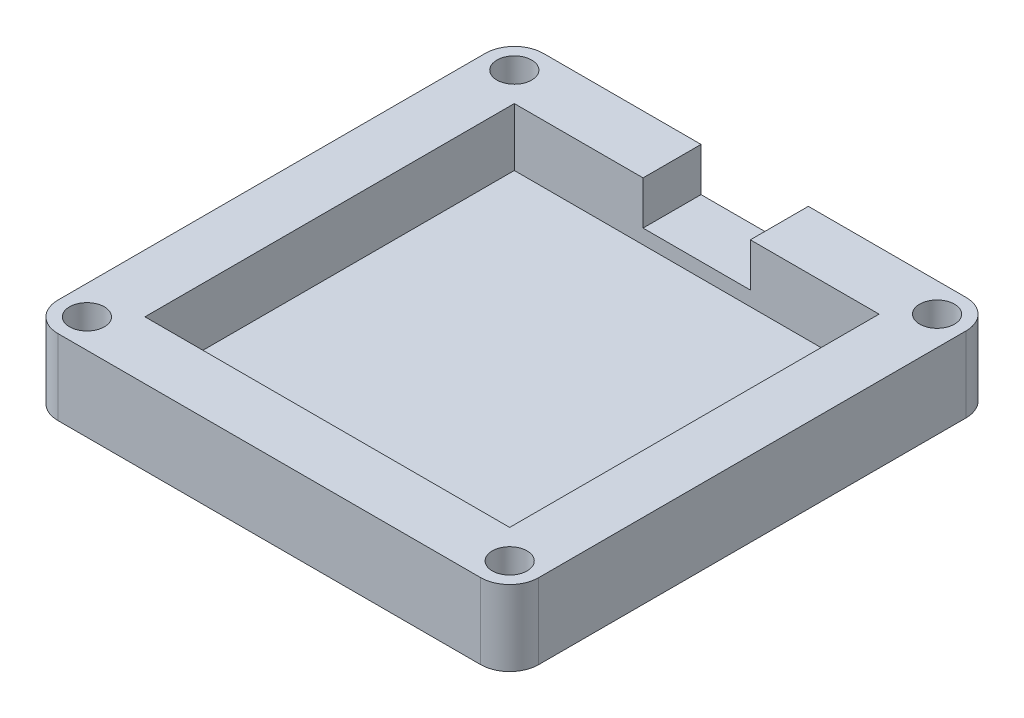
from build123d import *

# Parameters (mm, degrees)
SKETCH1_W           = 82.9
SKETCH1_H           = 83.7
SKETCH1_R           = 3
SKETCH1_W_2         = 62.9
SKETCH1_H_2         = 63.7
BOSS_EXTRUDE1_DEPTH = 13
SKETCH1_4_W         = 62.9
SKETCH1_4_H         = 63.7
BOSS_EXTRUDE2_DEPTH = 3
SKETCH2_W           = 18.5
SKETCH2_H           = 10
CUT_EXTRUDE1_DEPTH  = 7.5
FILLET1_R           = 5


with BuildPart() as part:
    # Sketch1 → Boss-Extrude1 (new body)
    with BuildSketch(Plane(origin=(0, 0, 0), x_dir=(1, 0, 0), z_dir=(0, 1, 0))):
        with Locations((-33.914696313, -1.170240017)):
            Rectangle(SKETCH1_W, SKETCH1_H)
        with Locations((-70.364696313, -38.020240017)):
            Circle(SKETCH1_R, mode=Mode.SUBTRACT)
        with Locations((2.535303687, -38.020240017)):
            Circle(SKETCH1_R, mode=Mode.SUBTRACT)
        with Locations((-70.364696313, 35.679759983)):
            Circle(SKETCH1_R, mode=Mode.SUBTRACT)
        with Locations((-33.914696313, -1.170240017)):
            Rectangle(SKETCH1_W_2, SKETCH1_H_2, mode=Mode.SUBTRACT)
        with Locations((2.535303687, 35.679759983)):
            Circle(SKETCH1_R, mode=Mode.SUBTRACT)
    extrude(amount=BOSS_EXTRUDE1_DEPTH)

    # Sketch1<4> → Boss-Extrude2 (add)
    with BuildSketch(Plane(origin=(0, 0, 0), x_dir=(1, 0, 0), z_dir=(0, 1, 0))):
        with Locations((-33.914696313, -1.170240017)):
            Rectangle(SKETCH1_4_W, SKETCH1_4_H)
    extrude(amount=BOSS_EXTRUDE2_DEPTH)

    # Sketch2 → Cut-Extrude1 (cut)
    with BuildSketch(Plane(origin=(0, 13, 0), x_dir=(1, 0, 0), z_dir=(0, 1, 0))):
        with Locations((-33.914696313, 35.679759983)):
            Rectangle(SKETCH2_W, SKETCH2_H)
    extrude(amount=-CUT_EXTRUDE1_DEPTH, mode=Mode.SUBTRACT)

    # Fillet1
    fillet1_edges = [part.edges().sort_by_distance(p)[0] for p in [
        (7.535303687, 6.5, 43.020240017),
        (-75.364696313, 6.5, 43.020240017),
        (7.535303687, 6.5, -40.679759983),
        (-75.364696313, 6.5, -40.679759983),
    ]]
    fillet(fillet1_edges, radius=FILLET1_R)


solid = part.part
